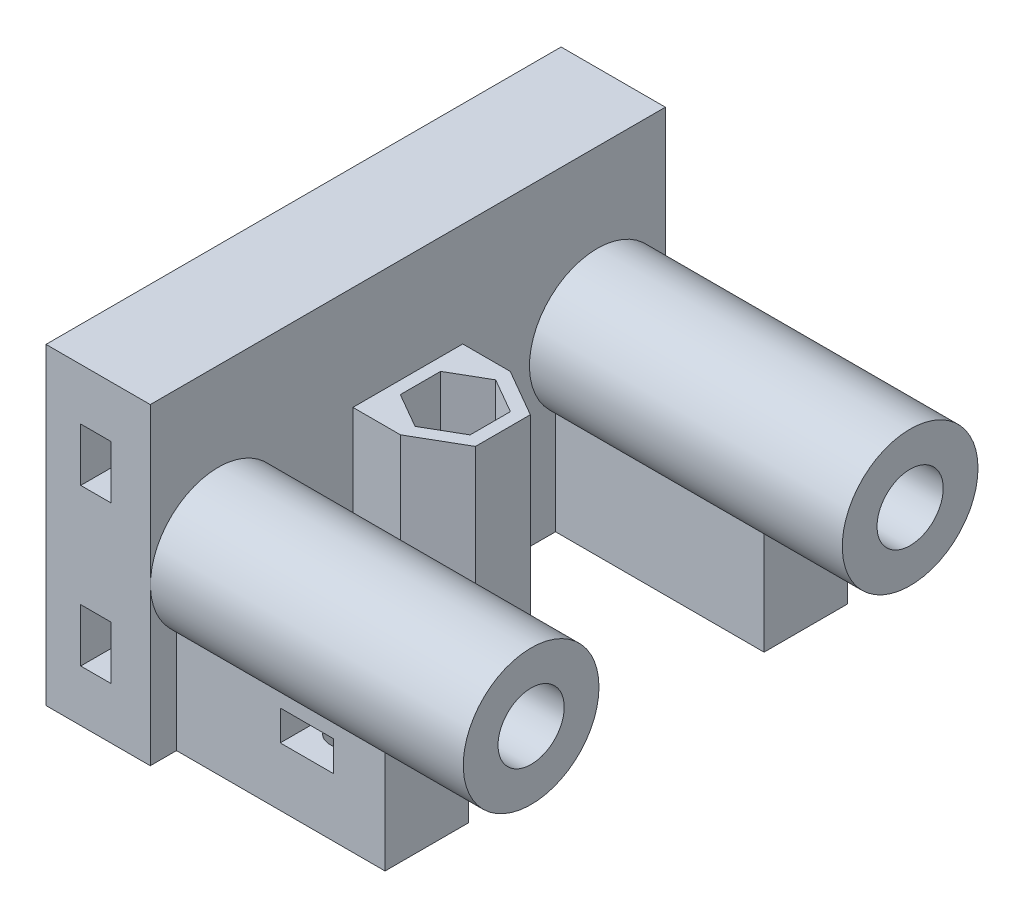
from build123d import *

# Parameters (mm, degrees)
SKETCH1_W               = 88.9
SKETCH1_H               = 76.2
BOSS_EXTRUDE1_DEPTH     = 25.4
SKETCH2_R               = 4.1021
CUT_EXTRUDE1_DEPTH      = 19.05
SKETCH5_W               = 88.9
SKETCH5_H               = 0.127
BOSS_EXTRUDE2_DEPTH     = 50.8
SKETCH6_R               = 16.53116582
SKETCH6_R_2             = 8.0645
BOSS_EXTRUDE3_DEPTH     = 76.2
BOSS_EXTRUDE4_DEPTH     = 18.288
SKETCH8_W               = 50.8
SKETCH8_H               = 20.36233164
BOSS_EXTRUDE5_DEPTH     = 27.94
CUT_EXTRUDE6_REACH      = 168.187
CUT_EXTRUDE6_END_RADIUS = 8.0645
SKETCH13_W              = 6.477
SKETCH13_H              = 7.366
CUT_EXTRUDE7_DEPTH      = 22.9616
BOSS_EXTRUDE6_DEPTH     = 50.8
CUT_EXTRUDE8_REACH      = 168.129
SKETCH14_3_R            = 5.25
CUT_EXTRUDE9_DEPTH      = 9
CUT_EXTRUDE10_REACH     = 168.129
SKETCH16_W              = 50.8
SKETCH16_H              = 6.39233418
BOSS_EXTRUDE7_DEPTH     = 50.8
BOSS_EXTRUDE9_START     = 19.05
BOSS_EXTRUDE9_DEPTH     = 19.05
SKETCH22_W              = 7.366
SKETCH22_H              = 12.954
CUT_EXTRUDE15_DEPTH     = 28.4988
MIRROR5_START           = 19.05
MIRROR5_COPY_1_DEPTH    = 19.05
MIRROR5_COPY_2_SKETCH_W = 7.366
MIRROR5_COPY_2_SKETCH_H = 12.954
MIRROR5_COPY_2_DEPTH    = 28.4988
SKETCH25_R              = 5.125
BOSS_EXTRUDE10_DEPTH    = 6.35


with BuildPart() as part:
    # Sketch1 → Boss-Extrude1 (new body)
    with BuildSketch(Plane(origin=(0, 0, 0), x_dir=(0, 0, -1), z_dir=(1, 0, 0))):
        with Locations((44.45, 38.1)):
            Rectangle(SKETCH1_W, SKETCH1_H)
    extrude(amount=BOSS_EXTRUDE1_DEPTH)

    # Sketch2 → Cut-Extrude1 (cut)
    with BuildSketch(Plane.ZY):
        with Locations((-85.09, 19.05)):
            Circle(SKETCH2_R)
        with Locations((-3.81, 57.15)):
            Circle(SKETCH2_R)
        with Locations((-3.81, 19.05)):
            Circle(SKETCH2_R)
        with Locations((-85.09, 57.15)):
            Circle(SKETCH2_R)
    extrude(amount=-CUT_EXTRUDE1_DEPTH, mode=Mode.SUBTRACT)

    # Sketch5 → Boss-Extrude2 (add)
    with BuildSketch(Plane(origin=(25.4, 0, 0), x_dir=(0, 0, -1), z_dir=(1, 0, 0))):
        with Locations((44.45, 0.0635)):
            Rectangle(SKETCH5_W, SKETCH5_H)
    extrude(amount=BOSS_EXTRUDE2_DEPTH)

    # Sketch6 → Boss-Extrude3 (add)
    # profile 1 of 2: a face of its own
    with BuildSketch(Plane(origin=(25.4, 0, 0), x_dir=(0, 0, -1), z_dir=(1, 0, 0))):
        with Locations(Location((-1.7145, 38.1635, 0), (0, 0, 275.953033203))):
            Circle(SKETCH6_R)
        with Locations(Location((-1.7145, 38.1635, 0), (0, 0, 77.725329785))):
            Circle(SKETCH6_R_2, mode=Mode.SUBTRACT)
    # profile 2 of 2: a face of its own
    with BuildSketch(Plane(origin=(25.4, 0, 0), x_dir=(0, 0, -1), z_dir=(1, 0, 0))):
        with Locations(Location((90.6145, 38.1635, 0), (0, 0, 264.046966797))):
            Circle(SKETCH6_R)
        with Locations(Location((90.6145, 38.1635, 0), (0, 0, 102.274670215))):
            Circle(SKETCH6_R_2, mode=Mode.SUBTRACT)
    extrude(amount=BOSS_EXTRUDE3_DEPTH)

    # Sketch7 → Boss-Extrude4 (add)
    with BuildSketch(Plane.XY):
        Polygon((76.2, 0.127), (25.4, 0.127), (25.4, 76.2), (0, 76.2), (0, 58.670238274), (19.05, 58.670238274), (19.05, 55.629761726), (0, 55.629761726), (0, 20.570238274), (19.05, 20.570238274), (19.05, 17.529761726), (0, 17.529761726), (0, 0), (76.2, 0), align=None)
    boss_extrude4 = extrude(amount=BOSS_EXTRUDE4_DEPTH)

    # Mirror2: Boss-Extrude4 across plane
    add(boss_extrude4.mirror(Plane.XY.offset(-44.45)))

    # Sketch8 → Boss-Extrude5 (add)
    with BuildSketch(Plane(origin=(0, 0.127, 0), x_dir=(1, 0, 0), z_dir=(0, 1, 0))):
        with Locations((50.8, -1.7145)):
            Rectangle(SKETCH8_W, SKETCH8_H)
    boss_extrude5 = extrude(amount=BOSS_EXTRUDE5_DEPTH)

    # Cut-Extrude6: up to this cylinder (the profile starts outside it)
    cut_extrude6_end = Plane(origin=(57.15, 38.1635, 1.7145), z_dir=(-1, 0, 0)) * Cylinder(CUT_EXTRUDE6_END_RADIUS, 353.503, mode=Mode.PRIVATE)
    # Sketch12 → Cut-Extrude6 (cut, up to the surface)
    with BuildSketch(Plane.XZ, mode=Mode.PRIVATE) as cut_extrude6_sk1:
        with BuildLine():
            ThreePointArc((52.6669, 1.7145), (57.15, -2.7686), (61.6331, 1.7145))
            Line((61.6331, 1.7145), (52.6669, 1.7145))
        make_face()
    cut_extrude6_tool1 = extrude(cut_extrude6_sk1.sketch, amount=-CUT_EXTRUDE6_REACH, mode=Mode.PRIVATE) - cut_extrude6_end
    # Sketch12 → Cut-Extrude6 (cut, up to the surface)
    with BuildSketch(Plane.XZ, mode=Mode.PRIVATE) as cut_extrude6_sk2:
        with BuildLine():
            Line((52.6669, 1.7145), (61.6331, 1.7145))
            ThreePointArc((61.6331, 1.7145), (57.15, 6.1976), (52.6669, 1.7145))
        make_face()
    cut_extrude6_tool2 = extrude(cut_extrude6_sk2.sketch, amount=-CUT_EXTRUDE6_REACH, mode=Mode.PRIVATE) - cut_extrude6_end
    # Sketch12 → Cut-Extrude6 (cut, up to the surface)
    with BuildSketch(Plane.XZ, mode=Mode.PRIVATE) as cut_extrude6_sk3:
        with BuildLine():
            ThreePointArc((52.6669, 1.7145), (57.15, -2.7686), (61.6331, 1.7145))
            Line((61.6331, 1.7145), (52.6669, 1.7145))
        make_face()
    cut_extrude6_tool3 = extrude(cut_extrude6_sk3.sketch, amount=-CUT_EXTRUDE6_REACH, mode=Mode.PRIVATE) - cut_extrude6_end
    # Sketch12 → Cut-Extrude6 (cut, up to the surface)
    with BuildSketch(Plane.XZ, mode=Mode.PRIVATE) as cut_extrude6_sk4:
        with BuildLine():
            Line((52.6669, 1.7145), (61.6331, 1.7145))
            ThreePointArc((61.6331, 1.7145), (57.15, 6.1976), (52.6669, 1.7145))
        make_face()
    cut_extrude6_tool4 = extrude(cut_extrude6_sk4.sketch, amount=-CUT_EXTRUDE6_REACH, mode=Mode.PRIVATE) - cut_extrude6_end
    cut_extrude6 = cut_extrude6_tool1.solids().sort_by_distance((57.15, 0, -0.188187))[0] + cut_extrude6_tool2.solids().sort_by_distance((57.15, 0, 3.617187))[0] + cut_extrude6_tool3.solids().sort_by_distance((57.15, 0, -0.188187))[0] + cut_extrude6_tool4.solids().sort_by_distance((57.15, 0, 3.617187))[0]
    add(cut_extrude6, mode=Mode.SUBTRACT)

    # Sketch13 → Cut-Extrude7 (cut)
    with BuildSketch(Plane.XY.offset(18.288)):
        with Locations((60.3885, 17.94933418)):
            Rectangle(SKETCH13_W, SKETCH13_H)
        with Locations((53.9115, 17.94933418)):
            Rectangle(SKETCH13_W, SKETCH13_H)
    cut_extrude7 = extrude(amount=-CUT_EXTRUDE7_DEPTH, mode=Mode.SUBTRACT)

    # Mirror3: Boss-Extrude5, Cut-Extrude6, Cut-Extrude7 across plane
    add(boss_extrude5.mirror(Plane.XY.offset(-44.45)))
    add(cut_extrude6.mirror(Plane.XY.offset(-44.45)), mode=Mode.SUBTRACT)
    add(cut_extrude7.mirror(Plane.XY.offset(-44.45)), mode=Mode.SUBTRACT)

    # Sketch14 → Boss-Extrude6 (add)
    with BuildSketch(Plane(origin=(0, 0.127, 0), x_dir=(1, 0, 0), z_dir=(0, 1, 0))):
        Polygon((48.563230368, 37.763351356), (48.563230368, 51.136648644), (36.981615184, 57.823297288), (25.4, 51.136648644), (25.4, 37.763351356), (36.981615184, 31.076702712), align=None)
        Polygon((28.481615184, 49.357477288), (28.481615184, 39.542522712), (36.981615184, 34.635045424), (45.481615184, 39.542522712), (45.481615184, 49.357477288), (36.981615184, 54.264954576), align=None, mode=Mode.SUBTRACT)
    extrude(amount=BOSS_EXTRUDE6_DEPTH)

    # Sketch14<3> → Cut-Extrude8 (cut, up to next)
    with BuildSketch(Plane(origin=(0, 0.127, 0), x_dir=(1, 0, 0), z_dir=(0, 1, 0)), mode=Mode.PRIVATE) as cut_extrude8_sk1:
        with Locations(Location((36.981615184, 44.45, 0), (0, 0, 270))):
            Circle(SKETCH14_3_R)
    cut_extrude8_tool1 = extrude(cut_extrude8_sk1.sketch, amount=-CUT_EXTRUDE8_REACH, mode=Mode.PRIVATE) & part.part
    add(cut_extrude8_tool1.solids().sort_by_distance((36.981615, 0.127, -44.45))[0], mode=Mode.SUBTRACT)

    # Sketch15 → Cut-Extrude9 (cut)
    with BuildSketch(Plane.XZ):
        Polygon((45.531615184, -39.513655198), (36.981615184, -34.577310397), (28.431615184, -39.513655198), (28.431615184, -49.386344802), (36.981615184, -54.322689603), (45.531615184, -49.386344802), align=None)
    extrude(amount=-CUT_EXTRUDE9_DEPTH, mode=Mode.SUBTRACT)

    # Sketch16 → Cut-Extrude10 (cut, up to next)
    with BuildSketch(Plane(origin=(0, 0.127, 0), x_dir=(1, 0, 0), z_dir=(0, 1, 0)), mode=Mode.PRIVATE) as cut_extrude10_sk1:
        Polygon((48.563230368, 37.763351356), (36.981615184, 31.076702712), (25.4, 31.076702712), (25.4, 8.46666582), (76.2, 8.46666582), (76.2, 80.43333418), (25.4, 80.43333418), (25.4, 57.823297288), (36.981615184, 57.823297288), (48.563230368, 51.136648644), align=None)
    cut_extrude10_tool1 = extrude(cut_extrude10_sk1.sketch, amount=-CUT_EXTRUDE10_REACH, mode=Mode.PRIVATE) & part.part
    # Sketch16 → Cut-Extrude10 (cut, up to next)
    with BuildSketch(Plane(origin=(0, 0.127, 0), x_dir=(1, 0, 0), z_dir=(0, 1, 0)), mode=Mode.PRIVATE) as cut_extrude10_sk2:
        with Locations((50.8, -15.09183291)):
            Rectangle(SKETCH16_W, SKETCH16_H)
    cut_extrude10_tool2 = extrude(cut_extrude10_sk2.sketch, amount=-CUT_EXTRUDE10_REACH, mode=Mode.PRIVATE) & part.part
    # Sketch16 → Cut-Extrude10 (cut, up to next)
    with BuildSketch(Plane(origin=(0, 0.127, 0), x_dir=(1, 0, 0), z_dir=(0, 1, 0)), mode=Mode.PRIVATE) as cut_extrude10_sk3:
        with Locations((50.8, 103.99183291)):
            Rectangle(SKETCH16_W, SKETCH16_H)
    cut_extrude10_tool3 = extrude(cut_extrude10_sk3.sketch, amount=-CUT_EXTRUDE10_REACH, mode=Mode.PRIVATE) & part.part
    add(cut_extrude10_tool1.solids().sort_by_distance((53.397723, 0.127, -44.45))[0], mode=Mode.SUBTRACT)
    add(cut_extrude10_tool2.solids().sort_by_distance((50.8, 0.127, 15.091833))[0], mode=Mode.SUBTRACT)
    add(cut_extrude10_tool3.solids().sort_by_distance((50.8, 0.127, -103.991833))[0], mode=Mode.SUBTRACT)

    # Sketch18 → Boss-Extrude7 (add)
    with BuildSketch(Plane(origin=(0, 0.127, 0), x_dir=(1, 0, 0), z_dir=(0, 1, 0))):
        Polygon((36.981615184, 57.823297288), (25.4, 57.823297288), (25.4, 51.136648644), align=None)
        Polygon((25.4, 37.763351356), (25.4, 31.076702712), (36.981615184, 31.076702712), align=None)
    extrude(amount=BOSS_EXTRUDE7_DEPTH)

    # Sketch20 → Boss-Extrude9 (add)
    with BuildSketch(Plane.ZY.offset(-19.05).offset(BOSS_EXTRUDE9_START)):
        with BuildLine():
            ThreePointArc((0.2921, 19.05), (0.218413175, 18.275976935), (0, 17.529761726))
            Line((0, 17.529761726), (18.288, 17.529761726))
            Line((18.288, 17.529761726), (18.288, 20.570238274))
            Line((18.288, 20.570238274), (0, 20.570238274))
            ThreePointArc((0, 20.570238274), (0.218413175, 19.824023065), (0.2921, 19.05))
        make_face()
    boss_extrude9 = extrude(amount=-BOSS_EXTRUDE9_DEPTH)

    # Sketch22 → Cut-Extrude15 (cut)
    with BuildSketch(Plane.XY.offset(18.288)):
        with Locations((12.1412, 19.05)):
            Rectangle(SKETCH22_W, SKETCH22_H)
    cut_extrude15 = extrude(amount=-CUT_EXTRUDE15_DEPTH, mode=Mode.SUBTRACT)

    # Mirror4: Boss-Extrude9, Cut-Extrude15 across plane
    add(boss_extrude9.mirror(Plane.XY.offset(-44.45)))
    add(cut_extrude15.mirror(Plane.XY.offset(-44.45)), mode=Mode.SUBTRACT)

    # Mirror5: Boss-Extrude9, Cut-Extrude15 across plane
    add(boss_extrude9.mirror(Plane.ZX.offset(38.1)))
    add(cut_extrude15.mirror(Plane.ZX.offset(38.1)), mode=Mode.SUBTRACT)

    # Mirror5 copy 1 sketch → Mirror5 copy 1 (add)
    with BuildSketch(Plane(origin=(19.05, 76.2, -88.9), x_dir=(0, 0, -1), z_dir=(-1, 0, 0)).offset(MIRROR5_START)):
        with BuildLine():
            ThreePointArc((0.2921, 19.05), (0.218413175, 18.275976935), (0, 17.529761726))
            Line((0, 17.529761726), (18.288, 17.529761726))
            Line((18.288, 17.529761726), (18.288, 20.570238274))
            Line((18.288, 20.570238274), (0, 20.570238274))
            ThreePointArc((0, 20.570238274), (0.218413175, 19.824023065), (0.2921, 19.05))
        make_face()
    extrude(amount=-MIRROR5_COPY_1_DEPTH)

    # Mirror5 copy 2 sketch → Mirror5 copy 2 (cut)
    with BuildSketch(Plane(origin=(0, 76.2, -107.188), x_dir=(1, 0, 0), z_dir=(0, 0, -1))):
        with Locations((12.1412, 19.05)):
            Rectangle(MIRROR5_COPY_2_SKETCH_W, MIRROR5_COPY_2_SKETCH_H)
    extrude(amount=-MIRROR5_COPY_2_DEPTH, mode=Mode.SUBTRACT)

    # Sketch25 → Boss-Extrude10 (add)
    with BuildSketch(Plane(origin=(0, 9.000000034, 0), x_dir=(-1, 0, 0), z_dir=(0, -1, 0))):
        Polygon((-36.981615184, 34.577310397), (-28.431615184, 39.513655198), (-28.431615184, 49.386344802), (-36.981615184, 54.322689603), (-45.531615184, 49.386344802), (-45.531615184, 39.513655198), align=None)
        with Locations(Location((-36.981615184, 44.45, 0), (0, 0, 90))):
            Circle(SKETCH25_R, mode=Mode.SUBTRACT)
    extrude(amount=-BOSS_EXTRUDE10_DEPTH)


solid = part.part
